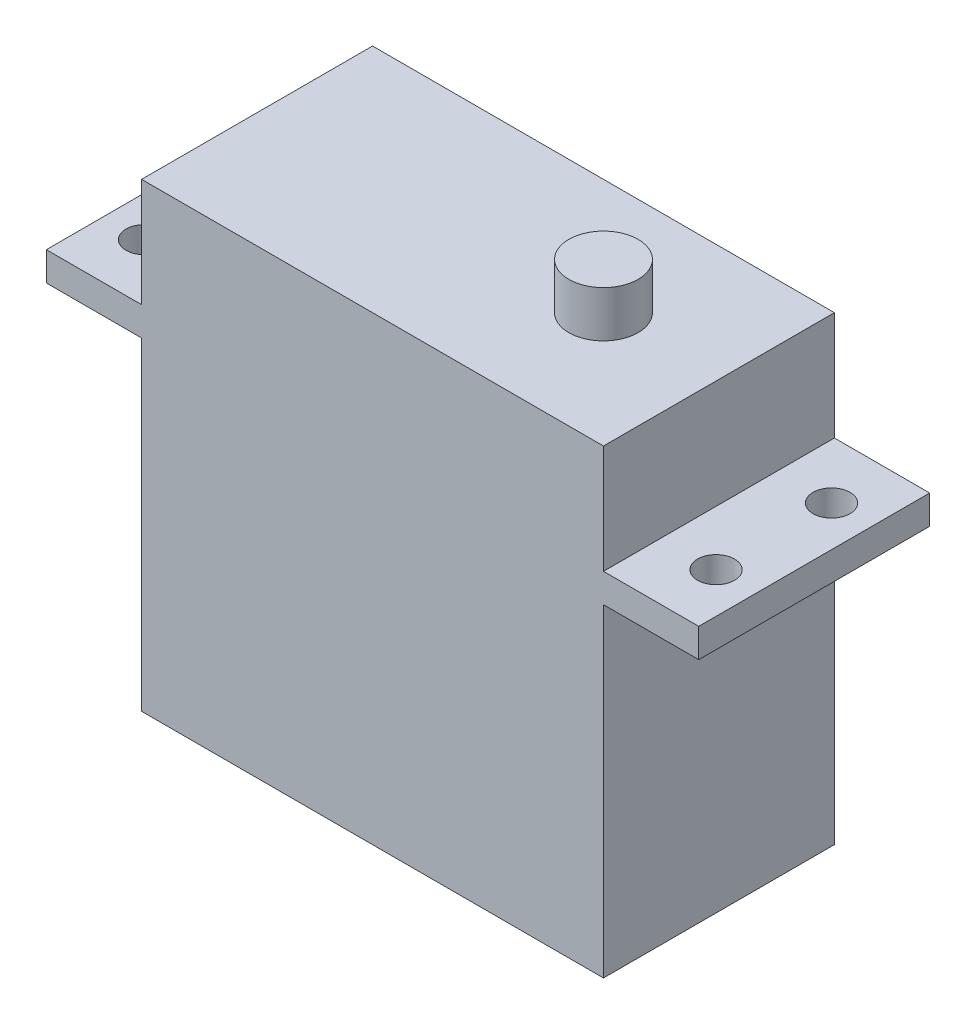
from build123d import *

# Parameters (mm, degrees)
CASE_SKETCH_W      = 40
CASE_SKETCH_H      = 39.9
CASE_2_DEPTH       = 20
TABS_SKETCH_W      = 8.25
TABS_SKETCH_H      = 2.5
TABS_DEPTH         = 20
SHAFT_SKETCH_W     = 3
SHAFT_SKETCH_H     = 4
TAB_HOLES_SKETCH_R = 1.6
TAB_HOLES_DEPTH    = 53.1


with BuildPart() as part:
    # Case Sketch → Case 2 (new body)
    with BuildSketch(Plane.XY.offset(14)):
        with Locations((-10, 37.55)):
            Rectangle(CASE_SKETCH_W, CASE_SKETCH_H)
    extrude(amount=CASE_2_DEPTH)

    # Tabs Sketch → Tabs (add)
    with BuildSketch(Plane.XY.offset(14)):
        with Locations((-34.125, 46.85)):
            Rectangle(TABS_SKETCH_W, TABS_SKETCH_H)
        with Locations((14.125, 46.85)):
            Rectangle(TABS_SKETCH_W, TABS_SKETCH_H)
    extrude(amount=TABS_DEPTH)

    # Shaft Sketch → Shaft (revolve)
    with BuildSketch(Plane.XY.offset(24)):
        with Locations((1.5, 59.5)):
            Rectangle(SHAFT_SKETCH_W, SHAFT_SKETCH_H)
    revolve(axis=Axis((0, -100, 24), (0, 1, 0)))

    # Tab Holes Sketch → Tab Holes (cut, symmetric)
    with BuildSketch(Plane(origin=(0, 0, 0), x_dir=(1, 0, 0), z_dir=(0, 1, 0))):
        with Locations((-34.75, -19)):
            Circle(TAB_HOLES_SKETCH_R)
        with Locations((-34.75, -29)):
            Circle(TAB_HOLES_SKETCH_R)
        with Locations((14.75, -19)):
            Circle(TAB_HOLES_SKETCH_R)
        with Locations((14.75, -29)):
            Circle(TAB_HOLES_SKETCH_R)
    extrude(amount=TAB_HOLES_DEPTH, both=True, mode=Mode.SUBTRACT)


solid = part.part
